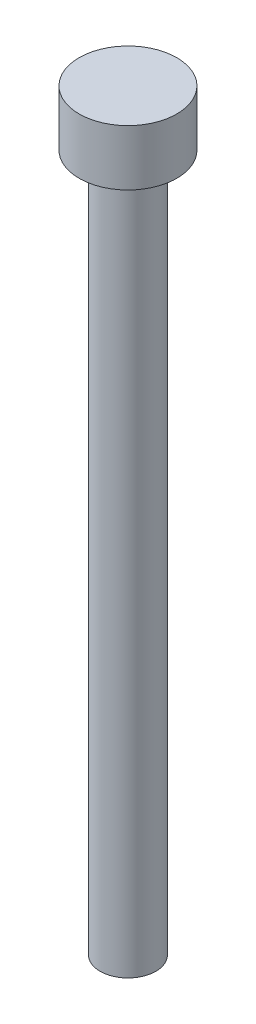
from build123d import *


with BuildPart() as part:
    # Sketch1 → Revolve1 (revolve)
    with BuildSketch(Plane.XY, mode=Mode.PRIVATE) as revolve1_sk:
        Polygon((0, 54), (0, 0), (2, 0), (2, 50), (3.5, 50), (3.5, 54), align=None)
    revolve(revolve1_sk.sketch.rotate(Axis((0, 54, 0), (0, -1, 0)), 180), axis=Axis((0, 54, 0), (0, -1, 0)))


solid = part.part
